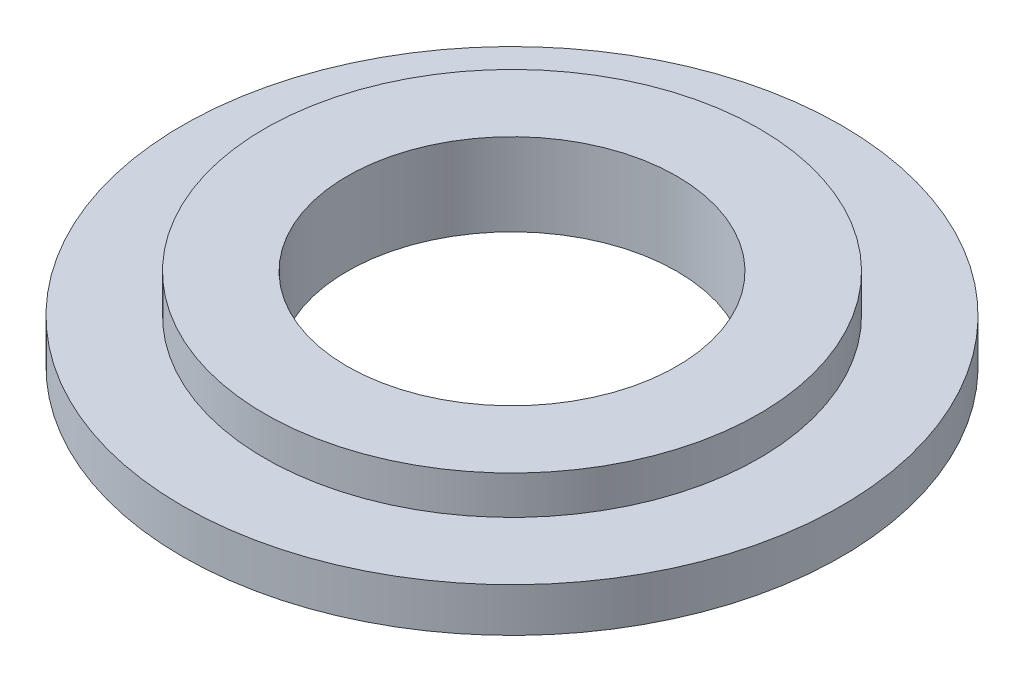
from build123d import *


with BuildPart() as part:
    # Sketch2 → Revolve1 (revolve)
    with BuildSketch(Plane(origin=(0, 0, 0), x_dir=(0, 0, -1), z_dir=(1, 0, 0)), mode=Mode.PRIVATE) as revolve1_sk:
        Polygon((-15, 0), (-7.499999024, 0), (-7.499999024, 3.75), (-11.25, 3.75), (-11.25, 2), (-15, 2), align=None)
    revolve(revolve1_sk.sketch.rotate(Axis((0, -1000, 0), (0, 1, 0)), 180), axis=Axis((0, -1000, 0), (0, 1, 0)))


solid = part.part
